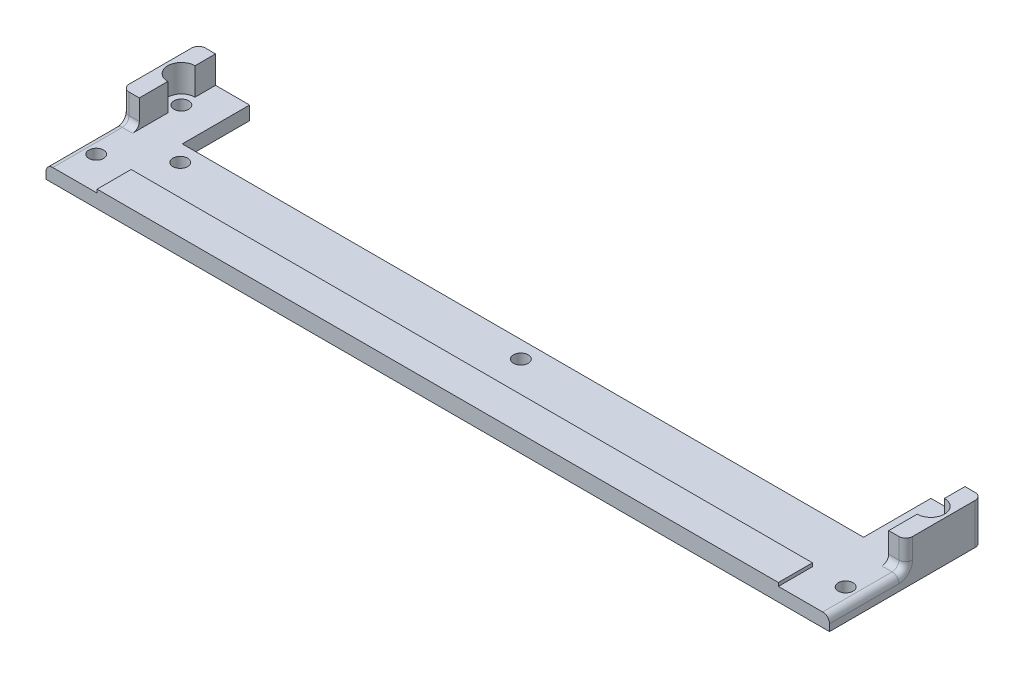
from build123d import *

# Parameters (mm, degrees)
BOSS_EXTRUDE1_DEPTH      = 2.54
BOSS_EXTRUDE1_DEPTH_BACK = 2.54
SKETCH1_R                = 2.75
BOSS_EXTRUDE2_DEPTH      = 10.16
FILLET1_R                = 2.54
SKETCH3_W                = 254
SKETCH3_H                = 12.7
BOSS_EXTRUDE3_DEPTH      = 1.27


with BuildPart() as part:
    # Sketch1 → Boss-Extrude1 (new, two sides: drawn at the far end of the back side and taken through both)
    with BuildSketch(Plane(origin=(0, 0, 0), x_dir=(1, 0, 0), z_dir=(0, 1, 0)).offset(-BOSS_EXTRUDE1_DEPTH_BACK)):
        Polygon((-146.05, -15.875), (146.05, -15.875), (146.05, 40.98799435), (127, 40.98799435), (127, 15.875), (-127, 15.875), (-127, 40.98799435), (-146.05, 40.98799435), align=None)
        with Locations((-139.7, 28.252118644)):
            Circle(SKETCH1_R, mode=Mode.SUBTRACT)
        with Locations((-139.7, -3.497881356)):
            Circle(SKETCH1_R, mode=Mode.SUBTRACT)
        with Locations((5.588, 9.525)):
            Circle(SKETCH1_R, mode=Mode.SUBTRACT)
        with Locations((-121.412, 9.525)):
            Circle(SKETCH1_R, mode=Mode.SUBTRACT)
        with Locations((139.7, 28.252118644)):
            Circle(SKETCH1_R, mode=Mode.SUBTRACT)
        with Locations((139.7, -3.497881356)):
            Circle(SKETCH1_R, mode=Mode.SUBTRACT)
    extrude(amount=BOSS_EXTRUDE1_DEPTH + BOSS_EXTRUDE1_DEPTH_BACK)

    # Sketch2 → Boss-Extrude2 (add)
    with BuildSketch(Plane(origin=(0, 2.54, 0), x_dir=(1, 0, 0), z_dir=(0, 1, 0))):
        with BuildLine():
            Line((-139.7, 33.332118644), (-139.7, 40.98799435))
            Line((-139.7, 40.98799435), (-146.05, 40.98799435))
            Line((-146.05, 40.98799435), (-146.05, 12.556497175))
            Line((-146.05, 12.556497175), (-139.7, 12.556497175))
            Line((-139.7, 12.556497175), (-139.7, 23.172118644))
            ThreePointArc((-139.7, 23.172118644), (-144.78, 28.252118644), (-139.7, 33.332118644))
        make_face()
        with BuildLine():
            Line((146.05, 40.98799435), (146.05, 12.556497175))
            Line((146.05, 12.556497175), (139.7, 12.556497175))
            Line((139.7, 12.556497175), (139.7, 23.172118644))
            ThreePointArc((139.7, 23.172118644), (144.78, 28.252118644), (139.7, 33.332118644))
            Line((139.7, 33.332118644), (139.7, 40.98799435))
            Line((139.7, 40.98799435), (146.05, 40.98799435))
        make_face()
    extrude(amount=BOSS_EXTRUDE2_DEPTH)

    # Fillet1
    fillet1_edges = [part.edges().sort_by_distance(p)[0] for p in [
        (146.05, 7.62, -12.556497175),
        (-146.05, 2.54, 1.659251412),
        (146.05, 5.08, -40.98799435),
        (142.875, 2.54, -12.556497175),
        (146.05, 2.54, 1.659251412),
        (-146.05, 5.08, -40.98799435),
        (-146.05, 7.62, -12.556497175),
        (-142.875, 2.54, -12.556497175),
    ]]
    fillet(fillet1_edges, radius=FILLET1_R)

    # Sketch3 → Boss-Extrude3 (add)
    with BuildSketch(Plane(origin=(0, 2.54, 0), x_dir=(1, 0, 0), z_dir=(0, 1, 0))):
        with Locations((0, -9.525)):
            Rectangle(SKETCH3_W, SKETCH3_H)
    extrude(amount=BOSS_EXTRUDE3_DEPTH)


solid = part.part
